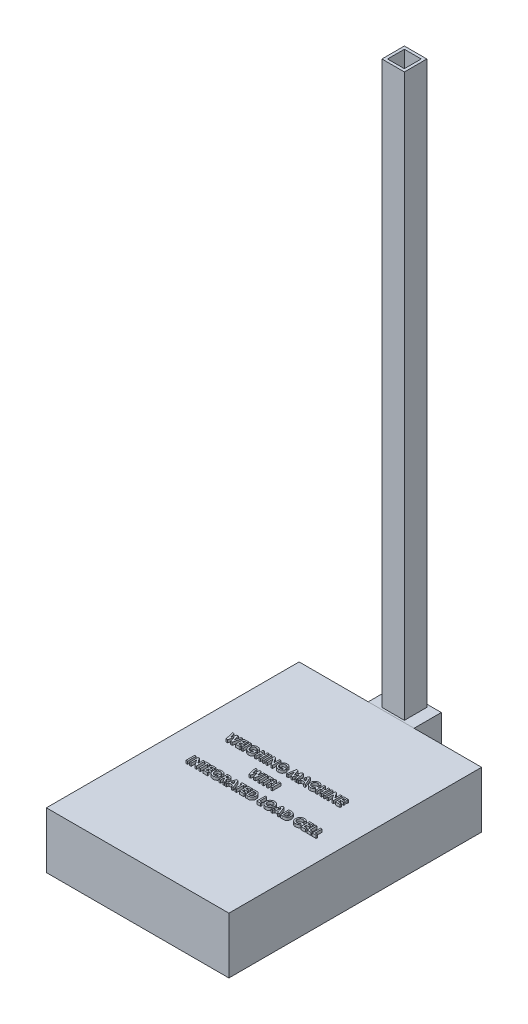
from build123d import *

# Parameters (mm, degrees)
SKETCH1_W           = 32.5
SKETCH1_H           = 45
BOSS_EXTRUDE1_DEPTH = 10
SKETCH2_W           = 0.269230769
SKETCH2_H           = 1.5
SKETCH2_W_2         = 0.26923077
BOSS_EXTRUDE2_DEPTH = 0.5
SKETCH3_W           = 8.15412896
SKETCH3_H           = 9.860807114
BOSS_EXTRUDE3_DEPTH = 5
SKETCH4_W           = 4
SKETCH4_H           = 4
SKETCH4_W_2         = 3
SKETCH4_H_2         = 3
BOSS_EXTRUDE4_DEPTH = 100


with BuildPart() as part:
    # Sketch1 → Boss-Extrude1 (new body)
    with BuildSketch(Plane(origin=(0, 0, 0), x_dir=(1, 0, 0), z_dir=(0, 1, 0))):
        Rectangle(SKETCH1_W, SKETCH1_H)
    extrude(amount=BOSS_EXTRUDE1_DEPTH)

    # Sketch2 → Boss-Extrude2 (add)
    # profile 1 of 37: a face of its own
    with BuildSketch(Plane(origin=(0, 10, 0), x_dir=(1, 0, 0), z_dir=(0, 1, 0))):
        Polygon((-10.748510339, 5.166197517), (-10.470565628, 5.166197517), (-10.248510339, 4.208565305), (-9.994003128, 5.166197517), (-9.732284378, 5.166197517), (-9.47927957, 4.208565305), (-9.257825243, 5.166197517), (-8.97927957, 5.166197517), (-9.326334859, 3.666197517), (-9.607584859, 3.666197517), (-9.863894955, 4.635848959), (-10.121707455, 3.666197517), (-10.400854089, 3.666197517), align=None)
    # profile 2 of 37: a face of its own
    with BuildSketch(Plane(origin=(0, 10, 0), x_dir=(1, 0, 0), z_dir=(0, 1, 0))):
        Polygon((-8.738894955, 5.166197517), (-7.931202647, 5.166197517), (-7.931202647, 4.896966747), (-8.469664185, 4.896966747), (-8.469664185, 4.608505209), (-7.931202647, 4.608505209), (-7.931202647, 4.33927444), (-8.469664185, 4.33927444), (-8.469664185, 3.935428286), (-7.931202647, 3.935428286), (-7.931202647, 3.666197517), (-8.738894955, 3.666197517), align=None)
    # profile 3 of 37: a face of its own
    with BuildSketch(Plane(origin=(0, 10, 0), x_dir=(1, 0, 0), z_dir=(0, 1, 0))):
        with Locations((-7.565818032, 4.416197517)):
            Rectangle(SKETCH2_W, SKETCH2_H)
    # profile 4 of 37: a face of its own
    with BuildSketch(Plane(origin=(0, 10, 0), x_dir=(1, 0, 0), z_dir=(0, 1, 0))):
        with BuildLine():
            Line((-5.710349282, 4.927615786), (-5.914075243, 4.732603767))
            add(Edge.make_bspline(
                [(-5.914075243, 4.732603767), (-5.930204583, 4.748752432), (-5.961853011, 4.78043878), (-6.013610055, 4.82168074), (-6.067214645, 4.856744559), (-6.122843215, 4.885576483), (-6.180573257, 4.907941031), (-6.240290843, 4.923939107), (-6.302093126, 4.933427837), (-6.343930514, 4.934756227), (-6.365096878, 4.935428286)],
                knots=[0, 0, 0, 0, 1.075575784, 2.110457258, 3.113929901, 4.09197124, 5.059417775, 6.02750972, 7.002078037, 8, 8, 8, 8], degree=3))
            add(Edge.make_bspline(
                [(-6.365096878, 4.935428286), (-6.383447468, 4.934957377), (-6.419480462, 4.934032707), (-6.472427475, 4.927010825), (-6.52302159, 4.915281086), (-6.571501833, 4.899031491), (-6.617572216, 4.877885632), (-6.66149968, 4.852169871), (-6.703013894, 4.82168748), (-6.741787964, 4.787016299), (-6.77709188, 4.749162369), (-6.807914062, 4.708645279), (-6.83416794, 4.666220233), (-6.855780236, 4.621670178), (-6.872224842, 4.575063489), (-6.88396414, 4.526434), (-6.891415675, 4.475923037), (-6.892295478, 4.441463934), (-6.892741109, 4.424010017)],
                knots=[0, 0, 0, 0, 1.075001177, 2.110859044, 3.123021556, 4.114053297, 5.101481495, 6.087880186, 7.091499647, 8.114004866, 9.131394192, 10.11971144, 11.092043119, 12.050101265, 13.015322563, 13.981809771, 14.977764287, 16, 16, 16, 16], degree=3))
            add(Edge.make_bspline(
                [(-6.892741109, 4.424010017), (-6.892325446, 4.405951996), (-6.891506534, 4.370375223), (-6.883639955, 4.318164779), (-6.871520137, 4.26793457), (-6.853779955, 4.220057292), (-6.831947164, 4.173877093), (-6.804259587, 4.130288527), (-6.771973102, 4.08862595), (-6.7351454, 4.049614731), (-6.69508637, 4.013655776), (-6.651701138, 3.982636655), (-6.606309748, 3.95587385), (-6.55817958, 3.934678573), (-6.508146033, 3.917661088), (-6.455701622, 3.9056623), (-6.400964439, 3.898301086), (-6.363617752, 3.897415955), (-6.344664185, 3.896966747)],
                knots=[0, 0, 0, 0, 1.022067601, 2.013613092, 2.983553406, 3.943623673, 4.90013463, 5.87121881, 6.861774014, 7.881098904, 8.905697761, 9.905387765, 10.89678721, 11.884561068, 12.87834324, 13.885584958, 14.926927371, 16, 16, 16, 16], degree=3))
            add(Edge.make_bspline(
                [(-6.344664185, 3.896966747), (-6.332335592, 3.897077986), (-6.30813182, 3.897296373), (-6.272629011, 3.900841399), (-6.238625848, 3.905909426), (-6.205990645, 3.912618892), (-6.17505293, 3.92211399), (-6.145384351, 3.933217339), (-6.117158737, 3.946321504), (-6.090529127, 3.961878603), (-6.065099193, 3.97931621), (-6.041106965, 3.999268541), (-6.018131591, 4.021285744), (-5.996441536, 4.045636789), (-5.97640391, 4.072539406), (-5.957376758, 4.101499221), (-5.939577937, 4.132803643), (-5.929061084, 4.154909241), (-5.923690628, 4.166197517)],
                knots=[0, 0, 0, 0, 1.109579412, 2.178351274, 3.208885622, 4.204702371, 5.174744997, 6.119429583, 7.05542196, 7.97267548, 8.893247984, 9.828544973, 10.778894627, 11.756245826, 12.760884819, 13.796418446, 14.874735809, 16, 16, 16, 16], degree=3))
            Line((-5.923690628, 4.166197517), (-6.35427957, 4.166197517))
            Line((-6.35427957, 4.166197517), (-6.35427957, 4.435428286))
            Line((-6.35427957, 4.435428286), (-5.606382935, 4.435428286))
            Line((-5.606382935, 4.435428286), (-5.60427957, 4.371425882))
            add(Edge.make_bspline(
                [(-5.60427957, 4.371425882), (-5.604549837, 4.354988441), (-5.605089888, 4.322142892), (-5.61002539, 4.273241466), (-5.618200975, 4.224988616), (-5.629377781, 4.177432806), (-5.643385147, 4.130340758), (-5.661248923, 4.084163416), (-5.682167296, 4.038587623), (-5.705604849, 3.993807039), (-5.731941914, 3.950838852), (-5.760297633, 3.91015365), (-5.790267773, 3.871821852), (-5.822504175, 3.836377515), (-5.856504864, 3.803522892), (-5.89233677, 3.773384377), (-5.93012663, 3.745936471), (-5.969674255, 3.7209473), (-6.011204907, 3.699045767), (-6.05449025, 3.679994338), (-6.099464931, 3.663814362), (-6.146245062, 3.650550301), (-6.194738593, 3.640316023), (-6.244946562, 3.633298365), (-6.296896543, 3.628529788), (-6.332133116, 3.62800378), (-6.350072839, 3.627735978)],
                knots=[0, 0, 0, 0, 1.006889344, 2.011981806, 3.007738725, 4.003571281, 5.003404394, 6.015442001, 7.03424805, 8.074616296, 9.110249922, 10.119753985, 11.111721717, 12.089233633, 13.052717867, 14.006597561, 14.955430184, 15.912305663, 16.870361111, 17.829300583, 18.807640451, 19.796414044, 20.806216501, 21.841577364, 22.90109906, 24, 24, 24, 24], degree=3))
            add(Edge.make_bspline(
                [(-6.350072839, 3.627735978), (-6.369213307, 3.628000438), (-6.407155424, 3.628524676), (-6.463257928, 3.63343452), (-6.517732863, 3.641537902), (-6.570593818, 3.652752705), (-6.621963523, 3.666710423), (-6.671753719, 3.684230661), (-6.71986257, 3.705071538), (-6.766434141, 3.728681179), (-6.810873196, 3.755456569), (-6.853080139, 3.784928199), (-6.892824598, 3.817285644), (-6.930513678, 3.851987235), (-6.965266817, 3.889885941), (-6.998379129, 3.92975328), (-7.028246436, 3.973051427), (-7.056152943, 4.018376644), (-7.080945307, 4.065709936), (-7.102626586, 4.114175851), (-7.121116368, 4.16349377), (-7.135696008, 4.213893335), (-7.14753331, 4.265023117), (-7.156003122, 4.317105467), (-7.16078642, 4.370133867), (-7.161574971, 4.405771698), (-7.161971878, 4.423709536)],
                knots=[0, 0, 0, 0, 1.084149091, 2.14910686, 3.187506334, 4.202448172, 5.208724393, 6.201130722, 7.189831603, 8.176984443, 9.156919086, 10.126598231, 11.090766514, 12.05840148, 13.026036446, 14.001772938, 14.991905635, 16.003017641, 17.015720547, 18.016462227, 19.009322657, 19.99686681, 20.986544154, 21.980959929, 22.983742515, 24, 24, 24, 24], degree=3))
            add(Edge.make_bspline(
                [(-7.161971878, 4.423709536), (-7.161440335, 4.44818058), (-7.160390696, 4.496503636), (-7.150669442, 4.567683805), (-7.135515456, 4.636543515), (-7.11376796, 4.702831986), (-7.085860787, 4.766640529), (-7.052189268, 4.828118939), (-7.012021984, 4.88720187), (-6.980929748, 4.92378241), (-6.965156974, 4.942339344)],
                knots=[0, 0, 0, 0, 1.034044851, 2.041932006, 3.031217818, 4.011390712, 4.986069675, 5.97149666, 6.970960976, 8, 8, 8, 8], degree=3))
            add(Edge.make_bspline(
                [(-6.965156974, 4.942339344), (-6.955363813, 4.953075093), (-6.935924535, 4.974385393), (-6.904850884, 5.003996488), (-6.872989198, 5.031832013), (-6.839898185, 5.057301733), (-6.8057518, 5.080963193), (-6.770451763, 5.102372839), (-6.734183249, 5.122212365), (-6.69666341, 5.139468691), (-6.658088665, 5.154940427), (-6.618288174, 5.168031691), (-6.577560034, 5.179627439), (-6.535543595, 5.18844883), (-6.492663325, 5.195794611), (-6.448614845, 5.200718137), (-6.403518189, 5.204326732), (-6.37301708, 5.204547405), (-6.357584859, 5.204659055)],
                knots=[0, 0, 0, 0, 1.020590567, 2.025856924, 3.013483481, 3.991664875, 4.957826714, 5.930500614, 6.890802512, 7.860442893, 8.829981142, 9.809047939, 10.802672283, 11.803273349, 12.823572789, 13.857849586, 14.916166035, 16, 16, 16, 16], degree=3))
            add(Edge.make_bspline(
                [(-6.357584859, 5.204659055), (-6.341453177, 5.204410277), (-6.309357055, 5.203915299), (-6.261635436, 5.200490379), (-6.214576941, 5.195206533), (-6.168379879, 5.187280464), (-6.122889212, 5.17750597), (-6.078340412, 5.164982424), (-6.034442851, 5.150753421), (-6.005865706, 5.139409008), (-5.991599282, 5.133745594)],
                knots=[0, 0, 0, 0, 1.03180557, 2.052914215, 3.058998889, 4.059601663, 5.049854447, 6.033765722, 7.018406786, 8, 8, 8, 8], degree=3))
            add(Edge.make_bspline(
                [(-5.991599282, 5.133745594), (-5.97959585, 5.12851158), (-5.955181204, 5.11786574), (-5.919660902, 5.098388677), (-5.884053814, 5.076796117), (-5.848744158, 5.052298587), (-5.813785738, 5.024941907), (-5.778813549, 4.995158173), (-5.744184601, 4.962600088), (-5.721773785, 4.939428244), (-5.710349282, 4.927615786)],
                knots=[0, 0, 0, 0, 0.894392155, 1.819168899, 2.76525314, 3.739198753, 4.75366411, 5.797420238, 6.877176959, 8, 8, 8, 8], degree=3))
        make_face()
    # profile 5 of 37: a face of its own
    with BuildSketch(Plane(origin=(0, 10, 0), x_dir=(1, 0, 0), z_dir=(0, 1, 0))):
        Polygon((-5.335048801, 5.166197517), (-5.065818032, 5.166197517), (-5.065818032, 4.58927444), (-4.546587262, 4.58927444), (-4.546587262, 5.166197517), (-4.277356493, 5.166197517), (-4.277356493, 3.666197517), (-4.546587262, 3.666197517), (-4.546587262, 4.320043671), (-5.065818032, 4.320043671), (-5.065818032, 3.666197517), (-5.335048801, 3.666197517), align=None)
    # profile 6 of 37: a face of its own
    with BuildSketch(Plane(origin=(0, 10, 0), x_dir=(1, 0, 0), z_dir=(0, 1, 0))):
        with Locations((-3.835048801, 4.416197517)):
            Rectangle(SKETCH2_W, SKETCH2_H)
    # profile 7 of 37: a face of its own
    with BuildSketch(Plane(origin=(0, 10, 0), x_dir=(1, 0, 0), z_dir=(0, 1, 0))):
        Polygon((-3.35427957, 5.166197517), (-3.111791589, 5.166197517), (-2.431202647, 4.17911819), (-2.431202647, 5.166197517), (-2.161971878, 5.166197517), (-2.161971878, 3.666197517), (-2.406262743, 3.666197517), (-3.085048801, 4.650272036), (-3.085048801, 3.666197517), (-3.35427957, 3.666197517), align=None)
    # profile 8 of 37: a face of its own
    with BuildSketch(Plane(origin=(0, 10, 0), x_dir=(1, 0, 0), z_dir=(0, 1, 0))):
        with BuildLine():
            Line((-0.441118512, 4.927615786), (-0.644844474, 4.732603767))
            add(Edge.make_bspline(
                [(-0.644844474, 4.732603767), (-0.660973814, 4.748752432), (-0.692622241, 4.78043878), (-0.744379286, 4.82168074), (-0.797983876, 4.856744559), (-0.853612446, 4.885576483), (-0.911342487, 4.907941031), (-0.971060073, 4.923939107), (-1.032862357, 4.933427837), (-1.074699744, 4.934756227), (-1.095866109, 4.935428286)],
                knots=[0, 0, 0, 0, 1.075575784, 2.110457258, 3.113929901, 4.09197124, 5.059417775, 6.02750972, 7.002078037, 8, 8, 8, 8], degree=3))
            add(Edge.make_bspline(
                [(-1.095866109, 4.935428286), (-1.114216699, 4.934957377), (-1.150249693, 4.934032707), (-1.203196706, 4.927010825), (-1.25379082, 4.915281086), (-1.302271064, 4.899031491), (-1.348341447, 4.877885632), (-1.392268911, 4.852169871), (-1.433783125, 4.82168748), (-1.472557195, 4.787016299), (-1.50786111, 4.749162369), (-1.538683293, 4.708645279), (-1.564937171, 4.666220233), (-1.586549466, 4.621670178), (-1.602994073, 4.575063489), (-1.614733371, 4.526434), (-1.622184905, 4.475923037), (-1.623064709, 4.441463934), (-1.623510339, 4.424010017)],
                knots=[0, 0, 0, 0, 1.075001177, 2.110859044, 3.123021556, 4.114053297, 5.101481495, 6.087880186, 7.091499647, 8.114004866, 9.131394192, 10.11971144, 11.092043119, 12.050101265, 13.015322563, 13.981809771, 14.977764287, 16, 16, 16, 16], degree=3))
            add(Edge.make_bspline(
                [(-1.623510339, 4.424010017), (-1.623094677, 4.405951996), (-1.622275764, 4.370375223), (-1.614409186, 4.318164779), (-1.602289368, 4.26793457), (-1.584549186, 4.220057292), (-1.562716395, 4.173877093), (-1.535028818, 4.130288527), (-1.502742333, 4.08862595), (-1.46591463, 4.049614731), (-1.425855601, 4.013655776), (-1.382470369, 3.982636655), (-1.337078978, 3.95587385), (-1.288948811, 3.934678573), (-1.238915264, 3.917661088), (-1.186470852, 3.9056623), (-1.131733669, 3.898301086), (-1.094386983, 3.897415955), (-1.075433416, 3.896966747)],
                knots=[0, 0, 0, 0, 1.022067601, 2.013613092, 2.983553406, 3.943623673, 4.90013463, 5.87121881, 6.861774014, 7.881098904, 8.905697761, 9.905387765, 10.89678721, 11.884561068, 12.87834324, 13.885584958, 14.926927371, 16, 16, 16, 16], degree=3))
            add(Edge.make_bspline(
                [(-1.075433416, 3.896966747), (-1.063104823, 3.897077986), (-1.038901051, 3.897296373), (-1.003398242, 3.900841399), (-0.969395079, 3.905909426), (-0.936759876, 3.912618892), (-0.905822161, 3.92211399), (-0.876153581, 3.933217339), (-0.847927968, 3.946321504), (-0.821298357, 3.961878603), (-0.795868424, 3.97931621), (-0.771876196, 3.999268541), (-0.748900822, 4.021285744), (-0.727210767, 4.045636789), (-0.707173141, 4.072539406), (-0.688145989, 4.101499221), (-0.670347168, 4.132803643), (-0.659830315, 4.154909241), (-0.654459859, 4.166197517)],
                knots=[0, 0, 0, 0, 1.109579412, 2.178351274, 3.208885622, 4.204702371, 5.174744997, 6.119429583, 7.05542196, 7.97267548, 8.893247984, 9.828544973, 10.778894627, 11.756245826, 12.760884819, 13.796418446, 14.874735809, 16, 16, 16, 16], degree=3))
            Line((-0.654459859, 4.166197517), (-1.085048801, 4.166197517))
            Line((-1.085048801, 4.166197517), (-1.085048801, 4.435428286))
            Line((-1.085048801, 4.435428286), (-0.337152166, 4.435428286))
            Line((-0.337152166, 4.435428286), (-0.335048801, 4.371425882))
            add(Edge.make_bspline(
                [(-0.335048801, 4.371425882), (-0.335319068, 4.354988441), (-0.335859119, 4.322142892), (-0.340794621, 4.273241466), (-0.348970206, 4.224988616), (-0.360147012, 4.177432806), (-0.374154378, 4.130340758), (-0.392018154, 4.084163416), (-0.412936527, 4.038587623), (-0.436374079, 3.993807039), (-0.462711145, 3.950838852), (-0.491066863, 3.91015365), (-0.521037004, 3.871821852), (-0.553273406, 3.836377515), (-0.587274095, 3.803522892), (-0.623106001, 3.773384377), (-0.66089586, 3.745936471), (-0.700443485, 3.7209473), (-0.741974137, 3.699045767), (-0.785259481, 3.679994338), (-0.830234162, 3.663814362), (-0.877014293, 3.650550301), (-0.925507824, 3.640316023), (-0.975715792, 3.633298365), (-1.027665774, 3.628529788), (-1.062902347, 3.62800378), (-1.08084207, 3.627735978)],
                knots=[0, 0, 0, 0, 1.006889344, 2.011981806, 3.007738725, 4.003571281, 5.003404394, 6.015442001, 7.03424805, 8.074616296, 9.110249922, 10.119753985, 11.111721717, 12.089233633, 13.052717867, 14.006597561, 14.955430184, 15.912305663, 16.870361111, 17.829300583, 18.807640451, 19.796414044, 20.806216501, 21.841577364, 22.90109906, 24, 24, 24, 24], degree=3))
            add(Edge.make_bspline(
                [(-1.08084207, 3.627735978), (-1.099982538, 3.628000438), (-1.137924654, 3.628524676), (-1.194027158, 3.63343452), (-1.248502094, 3.641537902), (-1.301363048, 3.652752705), (-1.352732754, 3.666710423), (-1.40252295, 3.684230661), (-1.450631801, 3.705071538), (-1.497203372, 3.728681179), (-1.541642426, 3.755456569), (-1.58384937, 3.784928199), (-1.623593828, 3.817285644), (-1.661282909, 3.851987235), (-1.696036048, 3.889885941), (-1.72914836, 3.92975328), (-1.759015667, 3.973051427), (-1.786922174, 4.018376644), (-1.811714538, 4.065709936), (-1.833395816, 4.114175851), (-1.851885598, 4.16349377), (-1.866465238, 4.213893335), (-1.878302541, 4.265023117), (-1.886772353, 4.317105467), (-1.891555651, 4.370133867), (-1.892344202, 4.405771698), (-1.892741109, 4.423709536)],
                knots=[0, 0, 0, 0, 1.084149091, 2.14910686, 3.187506334, 4.202448172, 5.208724393, 6.201130722, 7.189831603, 8.176984443, 9.156919086, 10.126598231, 11.090766514, 12.05840148, 13.026036446, 14.001772938, 14.991905635, 16.003017641, 17.015720547, 18.016462227, 19.009322657, 19.99686681, 20.986544154, 21.980959929, 22.983742515, 24, 24, 24, 24], degree=3))
            add(Edge.make_bspline(
                [(-1.892741109, 4.423709536), (-1.892209566, 4.44818058), (-1.891159926, 4.496503636), (-1.881438673, 4.567683805), (-1.866284687, 4.636543515), (-1.844537191, 4.702831986), (-1.816630018, 4.766640529), (-1.782958499, 4.828118939), (-1.742791215, 4.88720187), (-1.711698979, 4.92378241), (-1.695926205, 4.942339344)],
                knots=[0, 0, 0, 0, 1.034044851, 2.041932006, 3.031217818, 4.011390712, 4.986069675, 5.97149666, 6.970960976, 8, 8, 8, 8], degree=3))
            add(Edge.make_bspline(
                [(-1.695926205, 4.942339344), (-1.686133043, 4.953075093), (-1.666693766, 4.974385393), (-1.635620115, 5.003996488), (-1.603758429, 5.031832013), (-1.570667416, 5.057301733), (-1.536521031, 5.080963193), (-1.501220993, 5.102372839), (-1.46495248, 5.122212365), (-1.42743264, 5.139468691), (-1.388857896, 5.154940427), (-1.349057405, 5.168031691), (-1.308329264, 5.179627439), (-1.266312826, 5.18844883), (-1.223432556, 5.195794611), (-1.179384076, 5.200718137), (-1.13428742, 5.204326732), (-1.10378631, 5.204547405), (-1.088354089, 5.204659055)],
                knots=[0, 0, 0, 0, 1.020590567, 2.025856924, 3.013483481, 3.991664875, 4.957826714, 5.930500614, 6.890802512, 7.860442893, 8.829981142, 9.809047939, 10.802672283, 11.803273349, 12.823572789, 13.857849586, 14.916166035, 16, 16, 16, 16], degree=3))
            add(Edge.make_bspline(
                [(-1.088354089, 5.204659055), (-1.072222408, 5.204410277), (-1.040126285, 5.203915299), (-0.992404667, 5.200490379), (-0.945346172, 5.195206533), (-0.89914911, 5.187280464), (-0.853658443, 5.17750597), (-0.809109642, 5.164982424), (-0.765212082, 5.150753421), (-0.736634936, 5.139409008), (-0.722368512, 5.133745594)],
                knots=[0, 0, 0, 0, 1.03180557, 2.052914215, 3.058998889, 4.059601663, 5.049854447, 6.033765722, 7.018406786, 8, 8, 8, 8], degree=3))
            add(Edge.make_bspline(
                [(-0.722368512, 5.133745594), (-0.710365081, 5.12851158), (-0.685950434, 5.11786574), (-0.650430132, 5.098388677), (-0.614823044, 5.076796117), (-0.579513389, 5.052298587), (-0.544554969, 5.024941907), (-0.50958278, 4.995158173), (-0.474953832, 4.962600088), (-0.452543016, 4.939428244), (-0.441118512, 4.927615786)],
                knots=[0, 0, 0, 0, 0.894392155, 1.819168899, 2.76525314, 3.739198753, 4.75366411, 5.797420238, 6.877176959, 8, 8, 8, 8], degree=3))
        make_face()
    # profile 9 of 37: a face of its own
    with BuildSketch(Plane(origin=(0, 10, 0), x_dir=(1, 0, 0), z_dir=(0, 1, 0))):
        Polygon((0.629794949, 5.166197517), (0.909242065, 5.166197517), (1.251489661, 4.119923478), (1.596141103, 5.166197517), (1.872883891, 5.166197517), (2.126489661, 3.666197517), (1.853953603, 3.666197517), (1.693797353, 4.613613382), (1.381898315, 3.666197517), (1.119278122, 3.666197517), (0.809181968, 4.613613382), (0.649326199, 3.666197517), (0.376489661, 3.666197517), align=None)
    # profile 10 of 37: a face of its own
    with BuildSketch(Plane(origin=(0, 10, 0), x_dir=(1, 0, 0), z_dir=(0, 1, 0))):
        Polygon((2.838328603, 5.166197517), (3.088028122, 5.166197517), (3.693797353, 3.666197517), (3.406237257, 3.666197517), (3.289650718, 3.973889824), (2.636105045, 3.973889824), (2.519518507, 3.666197517), (2.232258891, 3.666197517), align=None)
        Polygon((2.963028122, 4.763853767), (2.738268507, 4.243120594), (3.187787738, 4.243120594), align=None, mode=Mode.SUBTRACT)
    # profile 11 of 37: a face of its own
    with BuildSketch(Plane(origin=(0, 10, 0), x_dir=(1, 0, 0), z_dir=(0, 1, 0))):
        with BuildLine():
            Line((5.261105045, 4.905981171), (5.06368918, 4.717279247))
            add(Edge.make_bspline(
                [(5.06368918, 4.717279247), (5.046942758, 4.734595076), (5.014231749, 4.768418314), (4.961522004, 4.8131973), (4.906705789, 4.850514526), (4.850849443, 4.881942856), (4.792948272, 4.905720628), (4.733671773, 4.923047891), (4.672641446, 4.933611668), (4.631338468, 4.934820351), (4.61056418, 4.935428286)],
                knots=[0, 0, 0, 0, 1.115251505, 2.178435587, 3.19620269, 4.182487026, 5.141301733, 6.088180966, 7.038406374, 8, 8, 8, 8], degree=3))
            add(Edge.make_bspline(
                [(4.61056418, 4.935428286), (4.593215125, 4.934947996), (4.558978675, 4.934000197), (4.508710596, 4.927051892), (4.46062658, 4.915235998), (4.414562029, 4.898951508), (4.370652489, 4.877880241), (4.328805898, 4.852038507), (4.289125428, 4.821659694), (4.252135234, 4.786900982), (4.218297905, 4.748924477), (4.18840047, 4.708403637), (4.163356572, 4.665431293), (4.142803453, 4.620442637), (4.126793368, 4.573229439), (4.115360155, 4.523823485), (4.108747491, 4.472165937), (4.107760506, 4.43704952), (4.107258891, 4.419202324)],
                knots=[0, 0, 0, 0, 1.035432265, 2.043311493, 3.022114605, 3.98653278, 4.95457646, 5.923598177, 6.917315552, 7.932509744, 8.948865224, 9.949768934, 10.933144597, 11.912367597, 12.897413939, 13.903909035, 14.934704909, 16, 16, 16, 16], degree=3))
            add(Edge.make_bspline(
                [(4.107258891, 4.419202324), (4.107403451, 4.406675914), (4.107688381, 4.381986101), (4.110807443, 4.345463015), (4.115829868, 4.310026987), (4.123098562, 4.275731693), (4.132188135, 4.242547413), (4.142852274, 4.210187868), (4.156230279, 4.179100193), (4.171080067, 4.148923326), (4.188350198, 4.12048068), (4.206970586, 4.093358256), (4.227161357, 4.067689006), (4.249053288, 4.043577867), (4.272954479, 4.021401641), (4.298247174, 4.000493464), (4.325358026, 3.981376738), (4.353723874, 3.963571707), (4.383589762, 3.948104325), (4.414145359, 3.934093865), (4.445853951, 3.922715288), (4.478329467, 3.913543118), (4.511455849, 3.905743556), (4.545557105, 3.900941127), (4.580337619, 3.897304303), (4.603843409, 3.89707975), (4.615672353, 3.896966747)],
                knots=[0, 0, 0, 0, 1.103660481, 2.175337485, 3.227646561, 4.255952547, 5.262355991, 6.258840057, 7.255597736, 8.242457506, 9.22035537, 10.185017736, 11.140346927, 12.096287581, 13.051739095, 14.01125915, 14.986044842, 15.97314143, 16.960198552, 17.947847494, 18.933482797, 19.925264591, 20.920966487, 21.929612487, 22.958107872, 24, 24, 24, 24], degree=3))
            add(Edge.make_bspline(
                [(4.615672353, 3.896966747), (4.635736275, 3.897547103), (4.675156663, 3.898687349), (4.733011751, 3.907603918), (4.788141886, 3.922271169), (4.832190601, 3.93959234), (4.866701605, 3.956697222), (4.892974322, 3.972518395), (4.920142359, 3.990216114), (4.947754479, 4.01045831), (4.976121262, 4.033002068), (5.00474197, 4.05834114), (5.034349298, 4.085641146), (5.053744765, 4.105125696), (5.06368918, 4.115115786)],
                knots=[0, 0, 0, 0, 1.404581149, 2.759636711, 4.088442092, 5.392261763, 6.066678138, 6.783632037, 7.538459478, 8.336747902, 9.180226004, 10.074962426, 11.012997595, 12, 12, 12, 12], degree=3))
            Line((5.06368918, 4.115115786), (5.25509543, 3.914094151))
            add(Edge.make_bspline(
                [(5.25509543, 3.914094151), (5.241640601, 3.901103936), (5.215379652, 3.875749814), (5.175765739, 3.839749327), (5.136201682, 3.807398888), (5.097643266, 3.777524316), (5.059458864, 3.750995932), (5.021652525, 3.72778724), (4.984652233, 3.70731126), (4.947689666, 3.689913309), (4.910534824, 3.675140642), (4.872306857, 3.662422344), (4.8328889, 3.651663123), (4.792040205, 3.642981844), (4.750141784, 3.63602063), (4.706801524, 3.631321851), (4.662294223, 3.628163018), (4.632104232, 3.627879171), (4.616874276, 3.627735978)],
                knots=[0, 0, 0, 0, 1.244526981, 2.429050516, 3.560637417, 4.644440555, 5.67424972, 6.652764056, 7.595344123, 8.486817594, 9.369275933, 10.254498637, 11.166417451, 12.086725134, 13.032340136, 13.991389299, 14.986715468, 16, 16, 16, 16], degree=3))
            add(Edge.make_bspline(
                [(4.616874276, 3.627735978), (4.588898734, 3.628449131), (4.534158376, 3.629844572), (4.453937807, 3.640183844), (4.37773042, 3.657517452), (4.305350817, 3.682031955), (4.236822012, 3.713348083), (4.172161538, 3.751740186), (4.111473612, 3.797106261), (4.055248474, 3.848914575), (4.004390161, 3.906132508), (3.959437301, 3.967568872), (3.922252294, 4.033525602), (3.891376782, 4.103028308), (3.867232537, 4.176394157), (3.850239082, 4.253702509), (3.839759342, 4.334878718), (3.838612844, 4.39032394), (3.838028122, 4.418601363)],
                knots=[0, 0, 0, 0, 1.078019885, 2.10938526, 3.111377082, 4.085535484, 5.04941344, 6.010039228, 6.978205633, 7.964457913, 8.951525778, 9.924444315, 10.892603023, 11.863865945, 12.85144698, 13.863884204, 14.910567087, 16, 16, 16, 16], degree=3))
            add(Edge.make_bspline(
                [(3.838028122, 4.418601363), (3.838275197, 4.437043657), (3.83876484, 4.473591776), (3.843911026, 4.527430116), (3.851085108, 4.579912868), (3.862466138, 4.630495086), (3.876184846, 4.679858207), (3.893245863, 4.72746571), (3.913621939, 4.773454424), (3.936656305, 4.817901338), (3.962714853, 4.860515277), (3.991825112, 4.900930118), (4.02323767, 4.939457859), (4.05770732, 4.975587356), (4.094733173, 5.009635834), (4.134482395, 5.041418777), (4.176715916, 5.071391989), (4.221548046, 5.098782534), (4.268107816, 5.123558737), (4.315807985, 5.145412406), (4.364531359, 5.163677042), (4.414071931, 5.178826883), (4.464639009, 5.190135168), (4.515871659, 5.198695175), (4.568205809, 5.203480274), (4.603343657, 5.204263625), (4.621081007, 5.204659055)],
                knots=[0, 0, 0, 0, 1.071919942, 2.124283339, 3.142214191, 4.149696895, 5.136002878, 6.119640489, 7.086990633, 8.058538607, 9.028339693, 9.988281803, 10.952401235, 11.916291999, 12.888973767, 13.874849856, 14.873389453, 15.898127285, 16.927174885, 17.938320013, 18.946391617, 19.950418109, 20.947802303, 21.956882652, 22.968648068, 24, 24, 24, 24], degree=3))
            add(Edge.make_bspline(
                [(4.621081007, 5.204659055), (4.636212785, 5.204432385), (4.666319013, 5.2039814), (4.711152238, 5.200221954), (4.755626908, 5.194317782), (4.79958379, 5.185409645), (4.843337309, 5.174834559), (4.886312493, 5.160987944), (4.929187301, 5.145553281), (4.971289304, 5.127104294), (5.01267727, 5.106965557), (5.052381622, 5.08411743), (5.091068991, 5.059965959), (5.127882089, 5.033081755), (5.163510504, 5.004439958), (5.197767932, 4.973906939), (5.230353745, 4.940973621), (5.250802792, 4.917704288), (5.261105045, 4.905981171)],
                knots=[0, 0, 0, 0, 0.996412454, 1.982464992, 2.961075852, 3.949442424, 4.934965278, 5.923860011, 6.921385422, 7.934793307, 8.949617135, 9.951082467, 10.950285876, 11.951772932, 12.951063433, 13.960125323, 14.972308753, 16, 16, 16, 16], degree=3))
        make_face()
    # profile 12 of 37: a face of its own
    with BuildSketch(Plane(origin=(0, 10, 0), x_dir=(1, 0, 0), z_dir=(0, 1, 0))):
        Polygon((5.530335815, 5.166197517), (5.799566584, 5.166197517), (5.799566584, 4.58927444), (6.318797353, 4.58927444), (6.318797353, 5.166197517), (6.588028122, 5.166197517), (6.588028122, 3.666197517), (6.318797353, 3.666197517), (6.318797353, 4.320043671), (5.799566584, 4.320043671), (5.799566584, 3.666197517), (5.530335815, 3.666197517), align=None)
    # profile 13 of 37: a face of its own
    with BuildSketch(Plane(origin=(0, 10, 0), x_dir=(1, 0, 0), z_dir=(0, 1, 0))):
        with Locations((7.030335815, 4.416197517)):
            Rectangle(SKETCH2_W, SKETCH2_H)
    # profile 14 of 37: a face of its own
    with BuildSketch(Plane(origin=(0, 10, 0), x_dir=(1, 0, 0), z_dir=(0, 1, 0))):
        Polygon((7.511105045, 5.166197517), (7.753593026, 5.166197517), (8.434181968, 4.17911819), (8.434181968, 5.166197517), (8.703412738, 5.166197517), (8.703412738, 3.666197517), (8.459121872, 3.666197517), (7.780335815, 4.650272036), (7.780335815, 3.666197517), (7.511105045, 3.666197517), align=None)
    # profile 15 of 37: a face of its own
    with BuildSketch(Plane(origin=(0, 10, 0), x_dir=(1, 0, 0), z_dir=(0, 1, 0))):
        Polygon((9.049566584, 5.166197517), (9.857258891, 5.166197517), (9.857258891, 4.896966747), (9.318797353, 4.896966747), (9.318797353, 4.608505209), (9.857258891, 4.608505209), (9.857258891, 4.33927444), (9.318797353, 4.33927444), (9.318797353, 3.935428286), (9.857258891, 3.935428286), (9.857258891, 3.666197517), (9.049566584, 3.666197517), align=None)
    # profile 16 of 37: a face of its own
    with BuildSketch(Plane(origin=(0, 10, 0), x_dir=(1, 0, 0), z_dir=(0, 1, 0))):
        Polygon((-3.248510339, 1.723889824), (-2.970565628, 1.723889824), (-2.748510339, 0.766257613), (-2.494003128, 1.723889824), (-2.232284378, 1.723889824), (-1.97927957, 0.766257613), (-1.757825243, 1.723889824), (-1.47927957, 1.723889824), (-1.826334859, 0.223889824), (-2.107584859, 0.223889824), (-2.363894955, 1.193541267), (-2.621707455, 0.223889824), (-2.900854089, 0.223889824), align=None)
    # profile 17 of 37: a face of its own
    with BuildSketch(Plane(origin=(0, 10, 0), x_dir=(1, 0, 0), z_dir=(0, 1, 0))):
        with Locations((-1.142741109, 0.973889824)):
            Rectangle(SKETCH2_W, SKETCH2_H)
    # profile 18 of 37: a face of its own
    with BuildSketch(Plane(origin=(0, 10, 0), x_dir=(1, 0, 0), z_dir=(0, 1, 0))):
        Polygon((-0.815818032, 1.723889824), (-0.008125724, 1.723889824), (-0.008125724, 1.454659055), (-0.277356493, 1.454659055), (-0.277356493, 0.223889824), (-0.546587262, 0.223889824), (-0.546587262, 1.454659055), (-0.815818032, 1.454659055), align=None)
    # profile 19 of 37: a face of its own
    with BuildSketch(Plane(origin=(0, 10, 0), x_dir=(1, 0, 0), z_dir=(0, 1, 0))):
        Polygon((0.203412738, 1.723889824), (0.472643507, 1.723889824), (0.472643507, 1.146966747), (0.991874276, 1.146966747), (0.991874276, 1.723889824), (1.261105045, 1.723889824), (1.261105045, 0.223889824), (0.991874276, 0.223889824), (0.991874276, 0.877735978), (0.472643507, 0.877735978), (0.472643507, 0.223889824), (0.203412738, 0.223889824), align=None)
    # profile 20 of 37: a face of its own
    with BuildSketch(Plane(origin=(0, 10, 0), x_dir=(1, 0, 0), z_dir=(0, 1, 0))):
        with Locations((-10.508125724, -2.468417868)):
            Rectangle(SKETCH2_W_2, SKETCH2_H)
    # profile 21 of 37: a face of its own
    with BuildSketch(Plane(origin=(0, 10, 0), x_dir=(1, 0, 0), z_dir=(0, 1, 0))):
        Polygon((-10.027356493, -1.718417868), (-9.784868512, -1.718417868), (-9.10427957, -2.705497195), (-9.10427957, -1.718417868), (-8.835048801, -1.718417868), (-8.835048801, -3.218417868), (-9.079339666, -3.218417868), (-9.758125724, -2.234343349), (-9.758125724, -3.218417868), (-10.027356493, -3.218417868), align=None)
    # profile 22 of 37: a face of its own
    with BuildSketch(Plane(origin=(0, 10, 0), x_dir=(1, 0, 0), z_dir=(0, 1, 0))):
        Polygon((-8.642741109, -1.718417868), (-7.835048801, -1.718417868), (-7.835048801, -1.987648637), (-8.10427957, -1.987648637), (-8.10427957, -3.218417868), (-8.373510339, -3.218417868), (-8.373510339, -1.987648637), (-8.642741109, -1.987648637), align=None)
    # profile 23 of 37: a face of its own
    with BuildSketch(Plane(origin=(0, 10, 0), x_dir=(1, 0, 0), z_dir=(0, 1, 0))):
        Polygon((-7.623510339, -1.718417868), (-6.815818032, -1.718417868), (-6.815818032, -1.987648637), (-7.35427957, -1.987648637), (-7.35427957, -2.276110176), (-6.815818032, -2.276110176), (-6.815818032, -2.545340945), (-7.35427957, -2.545340945), (-7.35427957, -2.949187099), (-6.815818032, -2.949187099), (-6.815818032, -3.218417868), (-7.623510339, -3.218417868), align=None)
    # profile 24 of 37: a face of its own
    with BuildSketch(Plane(origin=(0, 10, 0), x_dir=(1, 0, 0), z_dir=(0, 1, 0))):
        with BuildLine():
            Line((-5.171887743, -1.956999599), (-5.375613705, -2.152011618))
            add(Edge.make_bspline(
                [(-5.375613705, -2.152011618), (-5.391743045, -2.135862952), (-5.423391472, -2.104176604), (-5.475148517, -2.062934645), (-5.528753107, -2.027870826), (-5.584381677, -1.999038901), (-5.642111718, -1.976674354), (-5.701829304, -1.960676278), (-5.763631588, -1.951187547), (-5.805468975, -1.949859157), (-5.826635339, -1.949187099)],
                knots=[0, 0, 0, 0, 1.075575784, 2.110457258, 3.113929901, 4.09197124, 5.059417775, 6.02750972, 7.002078037, 8, 8, 8, 8], degree=3))
            add(Edge.make_bspline(
                [(-5.826635339, -1.949187099), (-5.84498593, -1.949658007), (-5.881018923, -1.950582677), (-5.933965937, -1.95760456), (-5.984560051, -1.969334299), (-6.033040295, -1.985583894), (-6.079110678, -2.006729753), (-6.123038142, -2.032445514), (-6.164552356, -2.062927905), (-6.203326426, -2.097599086), (-6.238630341, -2.135453016), (-6.269452524, -2.175970106), (-6.295706401, -2.218395152), (-6.317318697, -2.262945207), (-6.333763304, -2.309551896), (-6.345502601, -2.358181384), (-6.352954136, -2.408692348), (-6.35383394, -2.443151451), (-6.35427957, -2.460605368)],
                knots=[0, 0, 0, 0, 1.075001177, 2.110859044, 3.123021556, 4.114053297, 5.101481495, 6.087880186, 7.091499647, 8.114004866, 9.131394192, 10.11971144, 11.092043119, 12.050101265, 13.015322563, 13.981809771, 14.977764287, 16, 16, 16, 16], degree=3))
            add(Edge.make_bspline(
                [(-6.35427957, -2.460605368), (-6.353863907, -2.478663389), (-6.353044995, -2.514240162), (-6.345178417, -2.566450606), (-6.333058599, -2.616680815), (-6.315318417, -2.664558093), (-6.293485625, -2.710738292), (-6.265798049, -2.754326857), (-6.233511563, -2.795989434), (-6.196683861, -2.835000653), (-6.156624832, -2.870959609), (-6.1132396, -2.901978729), (-6.067848209, -2.928741535), (-6.019718042, -2.949936811), (-5.969684494, -2.966954297), (-5.917240083, -2.978953084), (-5.8625029, -2.986314299), (-5.825156214, -2.98719943), (-5.806202647, -2.987648637)],
                knots=[0, 0, 0, 0, 1.022067601, 2.013613092, 2.983553406, 3.943623673, 4.90013463, 5.87121881, 6.861774014, 7.881098904, 8.905697761, 9.905387765, 10.89678721, 11.884561068, 12.87834324, 13.885584958, 14.926927371, 16, 16, 16, 16], degree=3))
            add(Edge.make_bspline(
                [(-5.806202647, -2.987648637), (-5.793874054, -2.987537398), (-5.769670282, -2.987319012), (-5.734167473, -2.983773986), (-5.700164309, -2.978705959), (-5.667529106, -2.971996493), (-5.636591392, -2.962501394), (-5.606922812, -2.951398046), (-5.578697199, -2.938293881), (-5.552067588, -2.922736781), (-5.526637654, -2.905299174), (-5.502645427, -2.885346843), (-5.479670053, -2.863329641), (-5.457979998, -2.838978595), (-5.437942371, -2.812075979), (-5.418915219, -2.783116164), (-5.401116399, -2.751811742), (-5.390599546, -2.729706144), (-5.385229089, -2.718417868)],
                knots=[0, 0, 0, 0, 1.109579412, 2.178351274, 3.208885622, 4.204702371, 5.174744997, 6.119429583, 7.05542196, 7.97267548, 8.893247984, 9.828544973, 10.778894627, 11.756245826, 12.760884819, 13.796418446, 14.874735809, 16, 16, 16, 16], degree=3))
            Line((-5.385229089, -2.718417868), (-5.815818032, -2.718417868))
            Line((-5.815818032, -2.718417868), (-5.815818032, -2.449187099))
            Line((-5.815818032, -2.449187099), (-5.067921397, -2.449187099))
            Line((-5.067921397, -2.449187099), (-5.065818032, -2.513189503))
            add(Edge.make_bspline(
                [(-5.065818032, -2.513189503), (-5.066088298, -2.529626944), (-5.06662835, -2.562472492), (-5.071563852, -2.611373918), (-5.079739436, -2.659626768), (-5.090916243, -2.707182579), (-5.104923609, -2.754274627), (-5.122787385, -2.800451968), (-5.143705758, -2.846027762), (-5.16714331, -2.890808345), (-5.193480376, -2.933776533), (-5.221836094, -2.974461735), (-5.251806235, -3.012793533), (-5.284042637, -3.048237869), (-5.318043325, -3.081092493), (-5.353875232, -3.111231007), (-5.391665091, -3.138678914), (-5.431212716, -3.163668084), (-5.472743368, -3.185569618), (-5.516028712, -3.204621047), (-5.561003393, -3.220801023), (-5.607783524, -3.234065083), (-5.656277054, -3.244299361), (-5.706485023, -3.251317019), (-5.758435005, -3.256085596), (-5.793671578, -3.256611604), (-5.811611301, -3.256879406)],
                knots=[0, 0, 0, 0, 1.006889344, 2.011981806, 3.007738725, 4.003571281, 5.003404394, 6.015442001, 7.03424805, 8.074616296, 9.110249922, 10.119753985, 11.111721717, 12.089233633, 13.052717867, 14.006597561, 14.955430184, 15.912305663, 16.870361111, 17.829300583, 18.807640451, 19.796414044, 20.806216501, 21.841577364, 22.90109906, 24, 24, 24, 24], degree=3))
            add(Edge.make_bspline(
                [(-5.811611301, -3.256879406), (-5.830751769, -3.256614947), (-5.868693885, -3.256090709), (-5.924796389, -3.251180864), (-5.979271325, -3.243077483), (-6.032132279, -3.23186268), (-6.083501985, -3.217904962), (-6.13329218, -3.200384724), (-6.181401032, -3.179543847), (-6.227972603, -3.155934205), (-6.272411657, -3.129158815), (-6.314618601, -3.099687186), (-6.354363059, -3.06732974), (-6.392052139, -3.032628149), (-6.426805279, -2.994729444), (-6.459917591, -2.954862105), (-6.489784898, -2.911563958), (-6.517691405, -2.866238741), (-6.542483769, -2.818905448), (-6.564165047, -2.770439534), (-6.582654829, -2.721121614), (-6.597234469, -2.67072205), (-6.609071772, -2.619592268), (-6.617541583, -2.567509918), (-6.622324882, -2.514481518), (-6.623113433, -2.478843686), (-6.623510339, -2.460905849)],
                knots=[0, 0, 0, 0, 1.084149091, 2.14910686, 3.187506334, 4.202448172, 5.208724393, 6.201130722, 7.189831603, 8.176984443, 9.156919086, 10.126598231, 11.090766514, 12.05840148, 13.026036446, 14.001772938, 14.991905635, 16.003017641, 17.015720547, 18.016462227, 19.009322657, 19.99686681, 20.986544154, 21.980959929, 22.983742515, 24, 24, 24, 24], degree=3))
            add(Edge.make_bspline(
                [(-6.623510339, -2.460905849), (-6.622978797, -2.436434805), (-6.621929157, -2.388111749), (-6.612207904, -2.31693158), (-6.597053917, -2.248071869), (-6.575306422, -2.181783399), (-6.547399249, -2.117974855), (-6.51372773, -2.056496445), (-6.473560446, -1.997413515), (-6.442468209, -1.960832975), (-6.426695435, -1.942276041)],
                knots=[0, 0, 0, 0, 1.034044851, 2.041932006, 3.031217818, 4.011390712, 4.986069675, 5.97149666, 6.970960976, 8, 8, 8, 8], degree=3))
            add(Edge.make_bspline(
                [(-6.426695435, -1.942276041), (-6.416902274, -1.931540292), (-6.397462996, -1.910229992), (-6.366389346, -1.880618897), (-6.334527659, -1.852783371), (-6.301436647, -1.827313651), (-6.267290261, -1.803652192), (-6.231990224, -1.782242546), (-6.195721711, -1.762403019), (-6.158201871, -1.745146693), (-6.119627127, -1.729674957), (-6.079826635, -1.716583693), (-6.039098495, -1.704987945), (-5.997082057, -1.696166555), (-5.954201787, -1.688820774), (-5.910153307, -1.683897247), (-5.865056651, -1.680288652), (-5.834555541, -1.68006798), (-5.81912332, -1.679956329)],
                knots=[0, 0, 0, 0, 1.020590567, 2.025856924, 3.013483481, 3.991664875, 4.957826714, 5.930500614, 6.890802512, 7.860442893, 8.829981142, 9.809047939, 10.802672283, 11.803273349, 12.823572789, 13.857849586, 14.916166035, 16, 16, 16, 16], degree=3))
            add(Edge.make_bspline(
                [(-5.81912332, -1.679956329), (-5.802991639, -1.680205108), (-5.770895516, -1.680700085), (-5.723173897, -1.684125006), (-5.676115402, -1.689408851), (-5.62991834, -1.697334921), (-5.584427674, -1.707109415), (-5.539878873, -1.71963296), (-5.495981313, -1.733861964), (-5.467404167, -1.745206377), (-5.453137743, -1.750869791)],
                knots=[0, 0, 0, 0, 1.03180557, 2.052914215, 3.058998889, 4.059601663, 5.049854447, 6.033765722, 7.018406786, 8, 8, 8, 8], degree=3))
            add(Edge.make_bspline(
                [(-5.453137743, -1.750869791), (-5.441134312, -1.756103805), (-5.416719665, -1.766749645), (-5.381199363, -1.786226708), (-5.345592275, -1.807819267), (-5.31028262, -1.832316798), (-5.2753242, -1.859673477), (-5.240352011, -1.889457212), (-5.205723062, -1.922015297), (-5.183312247, -1.945187141), (-5.171887743, -1.956999599)],
                knots=[0, 0, 0, 0, 0.894392155, 1.819168899, 2.76525314, 3.739198753, 4.75366411, 5.797420238, 6.877176959, 8, 8, 8, 8], degree=3))
        make_face()
    # profile 25 of 37: a face of its own
    with BuildSketch(Plane(origin=(0, 10, 0), x_dir=(1, 0, 0), z_dir=(0, 1, 0))):
        with BuildLine():
            Line((-4.796587262, -1.718417868), (-4.482885339, -1.718417868))
            add(Edge.make_bspline(
                [(-4.482885339, -1.718417868), (-4.462149738, -1.718491467), (-4.422269335, -1.71863302), (-4.364763972, -1.720866344), (-4.311937388, -1.723974198), (-4.263711369, -1.728716865), (-4.220106545, -1.735005069), (-4.181079216, -1.742417821), (-4.146630521, -1.750866241), (-4.116469933, -1.761393639), (-4.089251494, -1.773268384), (-4.063880125, -1.786912683), (-4.039796096, -1.802174604), (-4.017160382, -1.819455729), (-3.995776273, -1.838445174), (-3.975603428, -1.859162054), (-3.956926907, -1.88178204), (-3.939862356, -1.906162202), (-3.924309392, -1.931809574), (-3.910563833, -1.958759368), (-3.899385922, -1.987030328), (-3.889509039, -2.016213877), (-3.882395041, -2.046727199), (-3.877447359, -2.078273242), (-3.87382486, -2.110963051), (-3.873616583, -2.133171056), (-3.873510339, -2.144499599)],
                knots=[0, 0, 0, 0, 1.749336639, 3.364467119, 4.854658419, 6.213483162, 7.451590619, 8.570285859, 9.5643256, 10.440900261, 11.26203566, 12.067320669, 12.869050712, 13.665104639, 14.467235401, 15.27997916, 16.102287765, 16.939272006, 17.78853747, 18.631303466, 19.488103222, 20.351255419, 21.228522269, 22.127379805, 23.044756219, 24, 24, 24, 24], degree=3))
            add(Edge.make_bspline(
                [(-3.873510339, -2.144499599), (-3.873786323, -2.156323995), (-3.874327477, -2.179509482), (-3.877242426, -2.21356707), (-3.882570038, -2.246150989), (-3.890639481, -2.277165836), (-3.899914258, -2.306997627), (-3.912247332, -2.335095947), (-3.926166425, -2.361869445), (-3.942697725, -2.386939401), (-3.960840019, -2.410862667), (-3.981939125, -2.432722655), (-4.004628146, -2.453694256), (-4.030182513, -2.472463881), (-4.057475767, -2.490300663), (-4.087050196, -2.506465538), (-4.118712787, -2.521364853), (-4.140973156, -2.52967374), (-4.152356493, -2.533922676)],
                knots=[0, 0, 0, 0, 1.099860209, 2.156625411, 3.176576793, 4.16617041, 5.135385252, 6.078461593, 7.016046972, 7.938469504, 8.868247731, 9.803980173, 10.76021508, 11.73834243, 12.748633912, 13.790971185, 14.870363756, 16, 16, 16, 16], degree=3))
            Line((-4.152356493, -2.533922676), (-3.806202647, -3.218417868))
            Line((-3.806202647, -3.218417868), (-4.105481493, -3.218417868))
            Line((-4.105481493, -3.218417868), (-4.436010339, -2.564571714))
            Line((-4.436010339, -2.564571714), (-4.527356493, -2.564571714))
            Line((-4.527356493, -2.564571714), (-4.527356493, -3.218417868))
            Line((-4.527356493, -3.218417868), (-4.796587262, -3.218417868))
            Line((-4.796587262, -3.218417868), (-4.796587262, -1.718417868))
        make_face()
        with BuildLine():
            Line((-4.527356493, -2.295340945), (-4.422488705, -2.295340945))
            add(Edge.make_bspline(
                [(-4.422488705, -2.295340945), (-4.409667746, -2.295196547), (-4.385118364, -2.294920055), (-4.34981313, -2.293637572), (-4.317747557, -2.290547422), (-4.288783945, -2.286643133), (-4.262776553, -2.282135068), (-4.239957356, -2.275674737), (-4.219974746, -2.268752329), (-4.203065518, -2.260149571), (-4.188618662, -2.250366369), (-4.176144726, -2.239252408), (-4.165826993, -2.226389415), (-4.157334972, -2.212126948), (-4.150729103, -2.19633886), (-4.145907325, -2.179198469), (-4.143212664, -2.160510523), (-4.142902634, -2.147613296), (-4.142741109, -2.140893829)],
                knots=[0, 0, 0, 0, 1.688639943, 3.233382647, 4.650958383, 5.928841754, 7.082724185, 8.122798841, 9.049171256, 9.863274652, 10.613301712, 11.341792392, 12.054588806, 12.776240173, 13.521029143, 14.301969904, 15.115324896, 16, 16, 16, 16], degree=3))
            add(Edge.make_bspline(
                [(-4.142741109, -2.140893829), (-4.143046488, -2.13294421), (-4.143646349, -2.117328657), (-4.149598837, -2.094847735), (-4.159073911, -2.074040104), (-4.172061643, -2.054999778), (-4.188418002, -2.038307713), (-4.207188215, -2.023593526), (-4.228777388, -2.011958647), (-4.248767338, -2.004284405), (-4.26695352, -1.999692826), (-4.283365975, -1.996271223), (-4.302371697, -1.993846234), (-4.323985034, -1.991274102), (-4.348150893, -1.989606205), (-4.375000992, -1.988388972), (-4.404458218, -1.987890942), (-4.424992702, -1.987731731), (-4.435709859, -1.987648637)],
                knots=[0, 0, 0, 0, 1.020303359, 2.004196876, 2.966617323, 3.9489082, 4.950758222, 5.960522915, 7.003732012, 8.091992268, 8.70421221, 9.413913587, 10.24622431, 11.166358409, 12.212345909, 13.359657661, 14.621978493, 16, 16, 16, 16], degree=3))
            Line((-4.435709859, -1.987648637), (-4.527356493, -1.987648637))
            Line((-4.527356493, -1.987648637), (-4.527356493, -2.295340945))
        make_face(mode=Mode.SUBTRACT)
    # profile 26 of 37: a face of its own
    with BuildSketch(Plane(origin=(0, 10, 0), x_dir=(1, 0, 0), z_dir=(0, 1, 0))):
        Polygon((-3.123209859, -1.718417868), (-2.873510339, -1.718417868), (-2.267741109, -3.218417868), (-2.555301205, -3.218417868), (-2.671887743, -2.91072556), (-3.325433416, -2.91072556), (-3.442019955, -3.218417868), (-3.72927957, -3.218417868), align=None)
        Polygon((-2.998510339, -2.120761618), (-3.223269955, -2.641494791), (-2.773750724, -2.641494791), align=None, mode=Mode.SUBTRACT)
    # profile 27 of 37: a face of its own
    with BuildSketch(Plane(origin=(0, 10, 0), x_dir=(1, 0, 0), z_dir=(0, 1, 0))):
        Polygon((-2.200433416, -1.718417868), (-1.392741109, -1.718417868), (-1.392741109, -1.987648637), (-1.661971878, -1.987648637), (-1.661971878, -3.218417868), (-1.931202647, -3.218417868), (-1.931202647, -1.987648637), (-2.200433416, -1.987648637), align=None)
    # profile 28 of 37: a face of its own
    with BuildSketch(Plane(origin=(0, 10, 0), x_dir=(1, 0, 0), z_dir=(0, 1, 0))):
        Polygon((-1.181202647, -1.718417868), (-0.373510339, -1.718417868), (-0.373510339, -1.987648637), (-0.911971878, -1.987648637), (-0.911971878, -2.276110176), (-0.373510339, -2.276110176), (-0.373510339, -2.545340945), (-0.911971878, -2.545340945), (-0.911971878, -2.949187099), (-0.373510339, -2.949187099), (-0.373510339, -3.218417868), (-1.181202647, -3.218417868), align=None)
    # profile 29 of 37: a face of its own
    with BuildSketch(Plane(origin=(0, 10, 0), x_dir=(1, 0, 0), z_dir=(0, 1, 0))):
        with BuildLine():
            Line((-0.10427957, -1.718417868), (0.234963218, -1.718417868))
            add(Edge.make_bspline(
                [(0.234963218, -1.718417868), (0.261411096, -1.718602748), (0.312535142, -1.718960122), (0.38660377, -1.722986874), (0.455478169, -1.729179733), (0.519202737, -1.737699133), (0.577646827, -1.748972631), (0.630735077, -1.763113026), (0.678645665, -1.779435759), (0.72190392, -1.798642766), (0.761394545, -1.82103623), (0.798892155, -1.84598075), (0.834323122, -1.874390118), (0.868184665, -1.90571626), (0.900039794, -1.940532279), (0.930419009, -1.978261495), (0.958578491, -2.019451033), (0.98536944, -2.0631133), (1.009598288, -2.10943333), (1.030731594, -2.158016858), (1.048435093, -2.20855123), (1.062820103, -2.261090303), (1.074286616, -2.315459664), (1.082309504, -2.371769023), (1.087269333, -2.42996625), (1.087772466, -2.469409368), (1.088028122, -2.489451522)],
                knots=[0, 0, 0, 0, 1.44355588, 2.790409838, 4.047694926, 5.217575253, 6.298404546, 7.294384826, 8.214239204, 9.058592145, 9.873746385, 10.689560431, 11.514393297, 12.350027578, 13.205127629, 14.088021785, 14.991911688, 15.926770944, 16.882954281, 17.842803888, 18.816321264, 19.80318086, 20.814351908, 21.847355356, 22.906180909, 24, 24, 24, 24], degree=3))
            add(Edge.make_bspline(
                [(1.088028122, -2.489451522), (1.087358677, -2.517732306), (1.086040834, -2.573404684), (1.074940061, -2.655103258), (1.056986352, -2.733419489), (1.031741807, -2.807740758), (1.000445329, -2.877405223), (0.963058182, -2.941184381), (0.920128548, -2.998735896), (0.872156559, -3.04977321), (0.820214579, -3.093640473), (0.766236388, -3.131209574), (0.70969614, -3.160835945), (0.659876279, -3.179623494), (0.616676245, -3.191307724), (0.578747082, -3.198213217), (0.535663422, -3.20454597), (0.487023549, -3.209439786), (0.433040835, -3.213803866), (0.373500104, -3.216175138), (0.308594132, -3.218145313), (0.263510797, -3.218324636), (0.240071391, -3.218417868)],
                knots=[0, 0, 0, 0, 1.315458931, 2.589557908, 3.828601765, 5.048913369, 6.235739168, 7.376350998, 8.481830359, 9.569842114, 10.627874879, 11.640079404, 12.624025415, 13.590060155, 14.111227486, 14.704434459, 15.382649715, 16.137166398, 16.978595427, 17.902333227, 18.909396075, 20, 20, 20, 20], degree=3))
            Line((0.240071391, -3.218417868), (-0.10427957, -3.218417868))
            Line((-0.10427957, -3.218417868), (-0.10427957, -1.718417868))
        make_face()
        with BuildLine():
            Line((0.164951199, -1.987648637), (0.164951199, -2.949187099))
            Line((0.164951199, -2.949187099), (0.305576199, -2.949187099))
            add(Edge.make_bspline(
                [(0.305576199, -2.949187099), (0.322308415, -2.949156438), (0.354490035, -2.949097468), (0.40095301, -2.946288674), (0.443919481, -2.943469419), (0.483271171, -2.938118378), (0.519294469, -2.932157696), (0.551494511, -2.92386259), (0.580535078, -2.915149284), (0.606061445, -2.904056165), (0.629441518, -2.891570122), (0.651088795, -2.876941275), (0.671984478, -2.860696492), (0.691737905, -2.842357991), (0.710423839, -2.822168608), (0.727931721, -2.800024316), (0.744495236, -2.775992679), (0.759689229, -2.749946634), (0.773573581, -2.722161234), (0.785890558, -2.692905621), (0.796103149, -2.661936159), (0.804591229, -2.62954276), (0.810656925, -2.595443401), (0.815675131, -2.559890652), (0.818262163, -2.522743657), (0.818617217, -2.4974676), (0.818797353, -2.484643829)],
                knots=[0, 0, 0, 0, 1.50275155, 2.890291501, 4.180787663, 5.369391935, 6.45668281, 7.458360028, 8.354766181, 9.177074746, 9.954075863, 10.732690366, 11.5210699, 12.329727389, 13.151100085, 13.990027547, 14.863562427, 15.770965086, 16.696477834, 17.652329173, 18.619756807, 19.62365428, 20.657822005, 21.729286259, 22.847956731, 24, 24, 24, 24], degree=3))
            add(Edge.make_bspline(
                [(0.818797353, -2.484643829), (0.818438583, -2.464992614), (0.817739009, -2.426674266), (0.810992473, -2.370862755), (0.800010398, -2.318307857), (0.784340035, -2.269204617), (0.764587057, -2.223415029), (0.739861601, -2.181327027), (0.711227754, -2.142233591), (0.68858489, -2.119300128), (0.677270911, -2.107840945)],
                knots=[0, 0, 0, 0, 1.13821349, 2.219428113, 3.251817212, 4.244760574, 5.201143372, 6.134805572, 7.068016741, 8, 8, 8, 8], degree=3))
            add(Edge.make_bspline(
                [(0.677270911, -2.107840945), (0.666114256, -2.098076172), (0.643328052, -2.078132729), (0.603322966, -2.054235383), (0.559239433, -2.033239223), (0.510068955, -2.01659161), (0.456286741, -2.003425968), (0.397572464, -1.994345946), (0.334240552, -1.98851122), (0.290365679, -1.987942325), (0.267715622, -1.987648637)],
                knots=[0, 0, 0, 0, 0.813307809, 1.661089106, 2.549956539, 3.493439533, 4.508053171, 5.589449661, 6.755572447, 8, 8, 8, 8], degree=3))
            Line((0.267715622, -1.987648637), (0.164951199, -1.987648637))
        make_face(mode=Mode.SUBTRACT)
    # profile 30 of 37: a face of its own
    with BuildSketch(Plane(origin=(0, 10, 0), x_dir=(1, 0, 0), z_dir=(0, 1, 0))):
        Polygon((1.934181968, -1.718417868), (2.203412738, -1.718417868), (2.203412738, -2.949187099), (2.626489661, -2.949187099), (2.626489661, -3.218417868), (1.934181968, -3.218417868), align=None)
    # profile 31 of 37: a face of its own
    with BuildSketch(Plane(origin=(0, 10, 0), x_dir=(1, 0, 0), z_dir=(0, 1, 0))):
        with BuildLine():
            add(Edge.make_bspline(
                [(3.562186776, -1.679956329), (3.588266114, -1.68063157), (3.639752635, -1.681964648), (3.715470728, -1.693076896), (3.78843911, -1.71118271), (3.858624786, -1.736351101), (3.925852019, -1.769263757), (3.990357942, -1.808987583), (4.051911497, -1.856272342), (4.109881934, -1.910014958), (4.163457073, -1.968457707), (4.209879962, -2.031381716), (4.249467698, -2.097156561), (4.28227812, -2.165958489), (4.307269364, -2.238263984), (4.324806753, -2.313704385), (4.336073657, -2.39225823), (4.337369524, -2.445742691), (4.338028122, -2.472925079)],
                knots=[0, 0, 0, 0, 1.014329547, 2.002516266, 2.970391464, 3.935626869, 4.897733899, 5.877609409, 6.878433252, 7.912639331, 8.949961323, 9.958554974, 10.949718813, 11.932905612, 12.9188844, 13.919928257, 14.942845884, 16, 16, 16, 16], degree=3))
            add(Edge.make_bspline(
                [(4.338028122, -2.472925079), (4.337326744, -2.499801185), (4.335944655, -2.552761414), (4.325266717, -2.630591354), (4.307433996, -2.705223631), (4.282866624, -2.776827177), (4.250651259, -2.84505517), (4.211835526, -2.910343234), (4.165395153, -2.972085482), (4.113024001, -3.030248781), (4.055367907, -3.083044454), (3.994300952, -3.129570551), (3.930105103, -3.168995009), (3.862874324, -3.201299771), (3.792464441, -3.226370307), (3.719049376, -3.244059391), (3.64263367, -3.254809405), (3.590667285, -3.256182467), (3.564290141, -3.256879406)],
                knots=[0, 0, 0, 0, 1.051557043, 2.072126891, 3.067553643, 4.050577992, 5.02905126, 6.015227836, 7.017913613, 8.04756643, 9.074058332, 10.072836633, 11.047628519, 12.017157415, 12.98668631, 13.966869689, 14.968021931, 16, 16, 16, 16], degree=3))
            add(Edge.make_bspline(
                [(3.564290141, -3.256879406), (3.536702812, -3.256254217), (3.482497481, -3.255025806), (3.403167735, -3.243344175), (3.327162985, -3.225747557), (3.255121713, -3.19948555), (3.18631024, -3.166655833), (3.121234145, -3.126224068), (3.059915297, -3.078257072), (3.002705432, -3.023983297), (2.950873155, -2.964595883), (2.905121004, -2.901858347), (2.86652805, -2.836249948), (2.835092881, -2.76773998), (2.810310656, -2.696754215), (2.792829612, -2.622860331), (2.782503142, -2.546235551), (2.781064725, -2.494190469), (2.780335815, -2.467816906)],
                knots=[0, 0, 0, 0, 1.067978421, 2.098431617, 3.099715153, 4.085208694, 5.062210972, 6.048429807, 7.046490867, 8.072918869, 9.098532598, 10.095778865, 11.076610158, 12.041847152, 13.011192615, 13.984257998, 14.978533688, 16, 16, 16, 16], degree=3))
            add(Edge.make_bspline(
                [(2.780335815, -2.467816906), (2.780564589, -2.450074154), (2.78101924, -2.414813313), (2.786495992, -2.362558547), (2.794380941, -2.311323724), (2.806042406, -2.261313117), (2.820208106, -2.212173926), (2.838561771, -2.16436355), (2.859453209, -2.117371243), (2.883862888, -2.071752042), (2.91100409, -2.027925683), (2.940617557, -1.986098902), (2.972777754, -1.946777446), (3.00738108, -1.909702911), (3.044546783, -1.87511899), (3.083785988, -1.8425361), (3.125859706, -1.812819757), (3.169847076, -1.785244231), (3.215500107, -1.76030816), (3.262632949, -1.739083323), (3.310274573, -1.720548034), (3.359061407, -1.705919164), (3.408470613, -1.694004103), (3.459030029, -1.686124468), (3.510282878, -1.680647868), (3.544844417, -1.680187389), (3.562186776, -1.679956329)],
                knots=[0, 0, 0, 0, 1.034744296, 2.056386356, 3.06226378, 4.057406941, 5.050368692, 6.043467995, 7.042652155, 8.049140477, 9.059438543, 10.048523776, 11.036952808, 12.020949711, 13.004946614, 13.997082645, 14.994316842, 16.007702937, 17.024872941, 18.026463647, 19.021641123, 20.005082605, 20.995858141, 21.984425357, 22.988620895, 24, 24, 24, 24], degree=3))
        make_face()
        with BuildLine():
            add(Edge.make_bspline(
                [(3.557980045, -1.949187099), (3.540428654, -1.949658042), (3.505789231, -1.950587495), (3.454979506, -1.957668674), (3.406200376, -1.968978121), (3.359722242, -1.985359716), (3.315343665, -2.00620933), (3.272985974, -2.031454111), (3.233235737, -2.061961819), (3.195562923, -2.096094633), (3.161531734, -2.134126431), (3.131464105, -2.174883971), (3.106302342, -2.218299189), (3.085229208, -2.263968766), (3.069365809, -2.312406246), (3.058066786, -2.363232212), (3.050926224, -2.41653424), (3.050026148, -2.452870163), (3.049566584, -2.471422676)],
                knots=[0, 0, 0, 0, 1.033739768, 2.040188636, 3.016340934, 3.979330865, 4.937572243, 5.900995986, 6.878200029, 7.884839167, 8.891893314, 9.879764717, 10.863503415, 11.843163062, 12.837761627, 13.859916423, 14.907309254, 16, 16, 16, 16], degree=3))
            add(Edge.make_bspline(
                [(3.049566584, -2.471422676), (3.050175896, -2.491983033), (3.051370045, -2.532277926), (3.05977223, -2.59105903), (3.074147532, -2.646571949), (3.094905187, -2.698545177), (3.120650126, -2.747555839), (3.152621255, -2.793003238), (3.190300791, -2.835159493), (3.219328801, -2.85977207), (3.234061776, -2.872264022)],
                knots=[0, 0, 0, 0, 1.078454662, 2.113592447, 3.107694534, 4.079536787, 5.043276885, 6.005368276, 6.987637804, 8, 8, 8, 8], degree=3))
            add(Edge.make_bspline(
                [(3.234061776, -2.872264022), (3.246130895, -2.881492596), (3.269997215, -2.899741823), (3.308093057, -2.92313195), (3.347324273, -2.943179623), (3.387986911, -2.959377906), (3.429995094, -2.972119202), (3.473343062, -2.981041723), (3.517969394, -2.986641376), (3.548147812, -2.987310641), (3.563388699, -2.987648637)],
                knots=[0, 0, 0, 0, 1.023928204, 2.024787132, 3.009472467, 3.9914905, 4.972207045, 5.96565515, 6.972602802, 8, 8, 8, 8], degree=3))
            add(Edge.make_bspline(
                [(3.563388699, -2.987648637), (3.580638294, -2.987173701), (3.614577414, -2.986239249), (3.664441288, -2.979245243), (3.712212395, -2.967408861), (3.7581873, -2.951170971), (3.802233433, -2.930059572), (3.844135528, -2.904031778), (3.883967051, -2.873407175), (3.921591871, -2.838826123), (3.955982735, -2.800644506), (3.985987619, -2.759669569), (4.0119494, -2.716804114), (4.032584318, -2.671441444), (4.049074444, -2.624009763), (4.060237478, -2.574299005), (4.067438361, -2.522514098), (4.068338691, -2.487272638), (4.068797353, -2.46931931)],
                knots=[0, 0, 0, 0, 1.026359118, 2.019393844, 2.989460624, 3.950973911, 4.916101784, 5.890408035, 6.881132271, 7.902007068, 8.92769091, 9.933912415, 10.920395702, 11.90457117, 12.894218921, 13.903490204, 14.931958862, 16, 16, 16, 16], degree=3))
            add(Edge.make_bspline(
                [(4.068797353, -2.46931931), (4.068322821, -2.451469219), (4.067388777, -2.416334035), (4.060382462, -2.364682267), (4.048621143, -2.315190967), (4.032334492, -2.267779313), (4.011537301, -2.222400823), (3.985819464, -2.179215075), (3.955271223, -2.138263818), (3.920595642, -2.099826121), (3.882853404, -2.064504339), (3.842333341, -2.033851453), (3.800169248, -2.007215069), (3.755393677, -1.986349202), (3.708922697, -1.96972541), (3.660472741, -1.957483411), (3.609860302, -1.950637241), (3.575427612, -1.949674788), (3.557980045, -1.949187099)],
                knots=[0, 0, 0, 0, 1.055025985, 2.07665775, 3.074803781, 4.057872707, 5.035505728, 6.020516407, 7.023567878, 8.050795229, 9.077271434, 10.074415901, 11.050397877, 12.019801805, 12.988065821, 13.964604439, 14.968634123, 16, 16, 16, 16], degree=3))
        make_face(mode=Mode.SUBTRACT)
    # profile 32 of 37: a face of its own
    with BuildSketch(Plane(origin=(0, 10, 0), x_dir=(1, 0, 0), z_dir=(0, 1, 0))):
        Polygon((5.069097834, -1.718417868), (5.318797353, -1.718417868), (5.924566584, -3.218417868), (5.637006488, -3.218417868), (5.520419949, -2.91072556), (4.866874276, -2.91072556), (4.750287738, -3.218417868), (4.463028122, -3.218417868), align=None)
        Polygon((5.193797353, -2.120761618), (4.969037738, -2.641494791), (5.418556968, -2.641494791), align=None, mode=Mode.SUBTRACT)
    # profile 33 of 37: a face of its own
    with BuildSketch(Plane(origin=(0, 10, 0), x_dir=(1, 0, 0), z_dir=(0, 1, 0))):
        with BuildLine():
            Line((6.14572043, -1.718417868), (6.484963218, -1.718417868))
            add(Edge.make_bspline(
                [(6.484963218, -1.718417868), (6.511411096, -1.718602748), (6.562535142, -1.718960122), (6.63660377, -1.722986874), (6.705478169, -1.729179733), (6.769202737, -1.737699133), (6.827646827, -1.748972631), (6.880735077, -1.763113026), (6.928645665, -1.779435759), (6.97190392, -1.798642766), (7.011394545, -1.82103623), (7.048892155, -1.84598075), (7.084323122, -1.874390118), (7.118184665, -1.90571626), (7.150039794, -1.940532279), (7.180419009, -1.978261495), (7.208578491, -2.019451033), (7.23536944, -2.0631133), (7.259598288, -2.10943333), (7.280731594, -2.158016858), (7.298435093, -2.20855123), (7.312820103, -2.261090303), (7.324286616, -2.315459664), (7.332309504, -2.371769023), (7.337269333, -2.42996625), (7.337772466, -2.469409368), (7.338028122, -2.489451522)],
                knots=[0, 0, 0, 0, 1.44355588, 2.790409838, 4.047694926, 5.217575253, 6.298404546, 7.294384826, 8.214239204, 9.058592145, 9.873746385, 10.689560431, 11.514393297, 12.350027578, 13.205127629, 14.088021785, 14.991911688, 15.926770944, 16.882954281, 17.842803888, 18.816321264, 19.80318086, 20.814351908, 21.847355356, 22.906180909, 24, 24, 24, 24], degree=3))
            add(Edge.make_bspline(
                [(7.338028122, -2.489451522), (7.337358677, -2.517732306), (7.336040834, -2.573404684), (7.324940061, -2.655103258), (7.306986352, -2.733419489), (7.281741807, -2.807740758), (7.250445329, -2.877405223), (7.213058182, -2.941184381), (7.170128548, -2.998735896), (7.122156559, -3.04977321), (7.070214579, -3.093640473), (7.016236388, -3.131209574), (6.95969614, -3.160835945), (6.909876279, -3.179623494), (6.866676245, -3.191307724), (6.828747082, -3.198213217), (6.785663422, -3.20454597), (6.737023549, -3.209439786), (6.683040835, -3.213803866), (6.623500104, -3.216175138), (6.558594132, -3.218145313), (6.513510797, -3.218324636), (6.490071391, -3.218417868)],
                knots=[0, 0, 0, 0, 1.315458931, 2.589557908, 3.828601765, 5.048913369, 6.235739168, 7.376350998, 8.481830359, 9.569842114, 10.627874879, 11.640079404, 12.624025415, 13.590060155, 14.111227486, 14.704434459, 15.382649715, 16.137166398, 16.978595427, 17.902333227, 18.909396075, 20, 20, 20, 20], degree=3))
            Line((6.490071391, -3.218417868), (6.14572043, -3.218417868))
            Line((6.14572043, -3.218417868), (6.14572043, -1.718417868))
        make_face()
        with BuildLine():
            Line((6.414951199, -1.987648637), (6.414951199, -2.949187099))
            Line((6.414951199, -2.949187099), (6.555576199, -2.949187099))
            add(Edge.make_bspline(
                [(6.555576199, -2.949187099), (6.572308415, -2.949156438), (6.604490035, -2.949097468), (6.65095301, -2.946288674), (6.693919481, -2.943469419), (6.733271171, -2.938118378), (6.769294469, -2.932157696), (6.801494511, -2.92386259), (6.830535078, -2.915149284), (6.856061445, -2.904056165), (6.879441518, -2.891570122), (6.901088795, -2.876941275), (6.921984478, -2.860696492), (6.941737905, -2.842357991), (6.960423839, -2.822168608), (6.977931721, -2.800024316), (6.994495236, -2.775992679), (7.009689229, -2.749946634), (7.023573581, -2.722161234), (7.035890558, -2.692905621), (7.046103149, -2.661936159), (7.054591229, -2.62954276), (7.060656925, -2.595443401), (7.065675131, -2.559890652), (7.068262163, -2.522743657), (7.068617217, -2.4974676), (7.068797353, -2.484643829)],
                knots=[0, 0, 0, 0, 1.50275155, 2.890291501, 4.180787663, 5.369391935, 6.45668281, 7.458360028, 8.354766181, 9.177074746, 9.954075863, 10.732690366, 11.5210699, 12.329727389, 13.151100085, 13.990027547, 14.863562427, 15.770965086, 16.696477834, 17.652329173, 18.619756807, 19.62365428, 20.657822005, 21.729286259, 22.847956731, 24, 24, 24, 24], degree=3))
            add(Edge.make_bspline(
                [(7.068797353, -2.484643829), (7.068438583, -2.464992614), (7.067739009, -2.426674266), (7.060992473, -2.370862755), (7.050010398, -2.318307857), (7.034340035, -2.269204617), (7.014587057, -2.223415029), (6.989861601, -2.181327027), (6.961227754, -2.142233591), (6.93858489, -2.119300128), (6.927270911, -2.107840945)],
                knots=[0, 0, 0, 0, 1.13821349, 2.219428113, 3.251817212, 4.244760574, 5.201143372, 6.134805572, 7.068016741, 8, 8, 8, 8], degree=3))
            add(Edge.make_bspline(
                [(6.927270911, -2.107840945), (6.916114256, -2.098076172), (6.893328052, -2.078132729), (6.853322966, -2.054235383), (6.809239433, -2.033239223), (6.760068955, -2.01659161), (6.706286741, -2.003425968), (6.647572464, -1.994345946), (6.584240552, -1.98851122), (6.540365679, -1.987942325), (6.517715622, -1.987648637)],
                knots=[0, 0, 0, 0, 0.813307809, 1.661089106, 2.549956539, 3.493439533, 4.508053171, 5.589449661, 6.755572447, 8, 8, 8, 8], degree=3))
            Line((6.517715622, -1.987648637), (6.414951199, -1.987648637))
        make_face(mode=Mode.SUBTRACT)
    # profile 34 of 37: a face of its own
    with BuildSketch(Plane(origin=(0, 10, 0), x_dir=(1, 0, 0), z_dir=(0, 1, 0))):
        with BuildLine():
            Line((9.530335815, -1.978634214), (9.332919949, -2.167336137))
            add(Edge.make_bspline(
                [(9.332919949, -2.167336137), (9.316173527, -2.150020309), (9.283462518, -2.116197071), (9.230752774, -2.071418085), (9.175936558, -2.034100859), (9.120080212, -2.002672528), (9.062179041, -1.978894757), (9.002902542, -1.961567494), (8.941872215, -1.951003717), (8.900569238, -1.949795034), (8.879794949, -1.949187099)],
                knots=[0, 0, 0, 0, 1.115251505, 2.178435587, 3.19620269, 4.182487026, 5.141301733, 6.088180966, 7.038406374, 8, 8, 8, 8], degree=3))
            add(Edge.make_bspline(
                [(8.879794949, -1.949187099), (8.862445894, -1.949667389), (8.828209444, -1.950615188), (8.777941365, -1.957563492), (8.729857349, -1.969379386), (8.683792798, -1.985663877), (8.639883258, -2.006735143), (8.598036667, -2.032576877), (8.558356197, -2.062955691), (8.521366003, -2.097714403), (8.487528674, -2.135690908), (8.457631239, -2.176211748), (8.432587342, -2.219184092), (8.412034222, -2.264172748), (8.396024137, -2.311385946), (8.384590924, -2.3607919), (8.37797826, -2.412449448), (8.376991275, -2.447565864), (8.376489661, -2.46541306)],
                knots=[0, 0, 0, 0, 1.035432265, 2.043311493, 3.022114605, 3.98653278, 4.95457646, 5.923598177, 6.917315552, 7.932509744, 8.948865224, 9.949768934, 10.933144597, 11.912367597, 12.897413939, 13.903909035, 14.934704909, 16, 16, 16, 16], degree=3))
            add(Edge.make_bspline(
                [(8.376489661, -2.46541306), (8.37663422, -2.477939471), (8.37691915, -2.502629284), (8.380038212, -2.53915237), (8.385060638, -2.574588398), (8.392329331, -2.608883691), (8.401418904, -2.642067971), (8.412083043, -2.674427517), (8.425461048, -2.705515191), (8.440310836, -2.735692059), (8.457580968, -2.764134705), (8.476201356, -2.791257129), (8.496392127, -2.816926379), (8.518284057, -2.841037518), (8.542185248, -2.863213743), (8.567477944, -2.88412192), (8.594588796, -2.903238647), (8.622954643, -2.921043678), (8.652820531, -2.93651106), (8.683376129, -2.95052152), (8.715084721, -2.961900096), (8.747560236, -2.971072267), (8.780686618, -2.978871828), (8.814787874, -2.983674258), (8.849568388, -2.987311082), (8.873074178, -2.987535634), (8.884903122, -2.987648637)],
                knots=[0, 0, 0, 0, 1.103660481, 2.175337485, 3.227646561, 4.255952547, 5.262355991, 6.258840057, 7.255597736, 8.242457506, 9.22035537, 10.185017736, 11.140346927, 12.096287581, 13.051739095, 14.01125915, 14.986044842, 15.97314143, 16.960198552, 17.947847494, 18.933482797, 19.925264591, 20.920966487, 21.929612487, 22.958107872, 24, 24, 24, 24], degree=3))
            add(Edge.make_bspline(
                [(8.884903122, -2.987648637), (8.904967044, -2.987068282), (8.944387432, -2.985928035), (9.00224252, -2.977011466), (9.057372656, -2.962344216), (9.10142137, -2.945023044), (9.135932374, -2.927918163), (9.162205091, -2.91209699), (9.189373129, -2.894399271), (9.216985248, -2.874157075), (9.245352031, -2.851613316), (9.273972739, -2.826274244), (9.303580067, -2.798974239), (9.322975534, -2.779489688), (9.332919949, -2.769499599)],
                knots=[0, 0, 0, 0, 1.404581149, 2.759636711, 4.088442092, 5.392261763, 6.066678138, 6.783632037, 7.538459478, 8.336747902, 9.180226004, 10.074962426, 11.012997595, 12, 12, 12, 12], degree=3))
            Line((9.332919949, -2.769499599), (9.524326199, -2.970521233))
            add(Edge.make_bspline(
                [(9.524326199, -2.970521233), (9.51087137, -2.983511448), (9.484610421, -3.00886557), (9.444996508, -3.044866057), (9.405432452, -3.077216497), (9.366874036, -3.107091068), (9.328689633, -3.133619453), (9.290883294, -3.156828144), (9.253883003, -3.177304124), (9.216920436, -3.194702076), (9.179765593, -3.209474743), (9.141537626, -3.22219304), (9.102119669, -3.232952262), (9.061270974, -3.241633541), (9.019372553, -3.248594755), (8.976032293, -3.253293534), (8.931524992, -3.256452366), (8.901335001, -3.256736214), (8.886105045, -3.256879406)],
                knots=[0, 0, 0, 0, 1.244526981, 2.429050516, 3.560637417, 4.644440555, 5.67424972, 6.652764056, 7.595344123, 8.486817594, 9.369275933, 10.254498637, 11.166417451, 12.086725134, 13.032340136, 13.991389299, 14.986715468, 16, 16, 16, 16], degree=3))
            add(Edge.make_bspline(
                [(8.886105045, -3.256879406), (8.858129504, -3.256166254), (8.803389145, -3.254770813), (8.723168576, -3.244431541), (8.64696119, -3.227097933), (8.574581586, -3.20258343), (8.506052782, -3.171267302), (8.441392307, -3.132875199), (8.380704381, -3.087509123), (8.324479243, -3.03570081), (8.27362093, -2.978482876), (8.228668071, -2.917046513), (8.191483064, -2.851089783), (8.160607551, -2.781587077), (8.136463306, -2.708221227), (8.119469851, -2.630912875), (8.108990112, -2.549736667), (8.107843613, -2.494291445), (8.107258891, -2.466014022)],
                knots=[0, 0, 0, 0, 1.078019885, 2.10938526, 3.111377082, 4.085535484, 5.04941344, 6.010039228, 6.978205633, 7.964457913, 8.951525778, 9.924444315, 10.892603023, 11.863865945, 12.85144698, 13.863884204, 14.910567087, 16, 16, 16, 16], degree=3))
            add(Edge.make_bspline(
                [(8.107258891, -2.466014022), (8.107505967, -2.447571728), (8.107995609, -2.411023609), (8.113141795, -2.357185268), (8.120315877, -2.304702516), (8.131696907, -2.254120298), (8.145415616, -2.204757178), (8.162476632, -2.157149675), (8.182852708, -2.11116096), (8.205887074, -2.066714046), (8.231945622, -2.024100108), (8.261055881, -1.983685266), (8.292468439, -1.945157526), (8.326938089, -1.909028028), (8.363963942, -1.874979551), (8.403713165, -1.843196607), (8.445946686, -1.813223395), (8.490778816, -1.785832851), (8.537338586, -1.761056648), (8.585038754, -1.739202978), (8.633762128, -1.720938343), (8.6833027, -1.705788502), (8.733869779, -1.694480217), (8.785102429, -1.68592021), (8.837436578, -1.681135111), (8.872574426, -1.68035176), (8.890311776, -1.679956329)],
                knots=[0, 0, 0, 0, 1.071919942, 2.124283339, 3.142214191, 4.149696895, 5.136002878, 6.119640489, 7.086990633, 8.058538607, 9.028339693, 9.988281803, 10.952401235, 11.916291999, 12.888973767, 13.874849856, 14.873389453, 15.898127285, 16.927174885, 17.938320013, 18.946391617, 19.950418109, 20.947802303, 21.956882652, 22.968648068, 24, 24, 24, 24], degree=3))
            add(Edge.make_bspline(
                [(8.890311776, -1.679956329), (8.905443554, -1.680183), (8.935549782, -1.680633984), (8.980383007, -1.68439343), (9.024857677, -1.690297602), (9.068814559, -1.69920574), (9.112568078, -1.709780825), (9.155543263, -1.723627441), (9.19841807, -1.739062104), (9.240520073, -1.757511091), (9.281908039, -1.777649827), (9.321612391, -1.800497955), (9.36029976, -1.824649426), (9.397112858, -1.85153363), (9.432741273, -1.880175426), (9.466998702, -1.910708446), (9.499584514, -1.943641764), (9.520033561, -1.966911097), (9.530335815, -1.978634214)],
                knots=[0, 0, 0, 0, 0.996412454, 1.982464992, 2.961075852, 3.949442424, 4.934965278, 5.923860011, 6.921385422, 7.934793307, 8.949617135, 9.951082467, 10.950285876, 11.951772932, 12.951063433, 13.960125323, 14.972308753, 16, 16, 16, 16], degree=3))
        make_face()
    # profile 35 of 37: a face of its own
    with BuildSketch(Plane(origin=(0, 10, 0), x_dir=(1, 0, 0), z_dir=(0, 1, 0))):
        Polygon((9.799566584, -1.718417868), (10.607258891, -1.718417868), (10.607258891, -1.987648637), (10.068797353, -1.987648637), (10.068797353, -2.276110176), (10.607258891, -2.276110176), (10.607258891, -2.545340945), (10.068797353, -2.545340945), (10.068797353, -2.949187099), (10.607258891, -2.949187099), (10.607258891, -3.218417868), (9.799566584, -3.218417868), align=None)
    # profile 36 of 37: a face of its own
    with BuildSketch(Plane(origin=(0, 10, 0), x_dir=(1, 0, 0), z_dir=(0, 1, 0))):
        Polygon((10.876489661, -1.718417868), (11.14572043, -1.718417868), (11.14572043, -2.949187099), (11.568797353, -2.949187099), (11.568797353, -3.218417868), (10.876489661, -3.218417868), align=None)
    # profile 37 of 37: a face of its own
    with BuildSketch(Plane(origin=(0, 10, 0), x_dir=(1, 0, 0), z_dir=(0, 1, 0))):
        Polygon((11.799566584, -1.718417868), (12.068797353, -1.718417868), (12.068797353, -2.949187099), (12.491874276, -2.949187099), (12.491874276, -3.218417868), (11.799566584, -3.218417868), align=None)
    extrude(amount=BOSS_EXTRUDE2_DEPTH)

    # Sketch3 → Boss-Extrude3 (add)
    with BuildSketch(Plane(origin=(0, 0, -22.5), x_dir=(-1, 0, 0), z_dir=(0, 0, -1))):
        with Locations((0, 4.930403557)):
            Rectangle(SKETCH3_W, SKETCH3_H)
    extrude(amount=BOSS_EXTRUDE3_DEPTH)

    # Sketch4 → Boss-Extrude4 (add)
    with BuildSketch(Plane(origin=(0, 9.860807114, 0), x_dir=(1, 0, 0), z_dir=(0, 1, 0))):
        with Locations((-0.00206448, 25)):
            Rectangle(SKETCH4_W, SKETCH4_H)
        with Locations((-0.00206448, 25)):
            Rectangle(SKETCH4_W_2, SKETCH4_H_2, mode=Mode.SUBTRACT)
    extrude(amount=BOSS_EXTRUDE4_DEPTH)


solid = part.part
